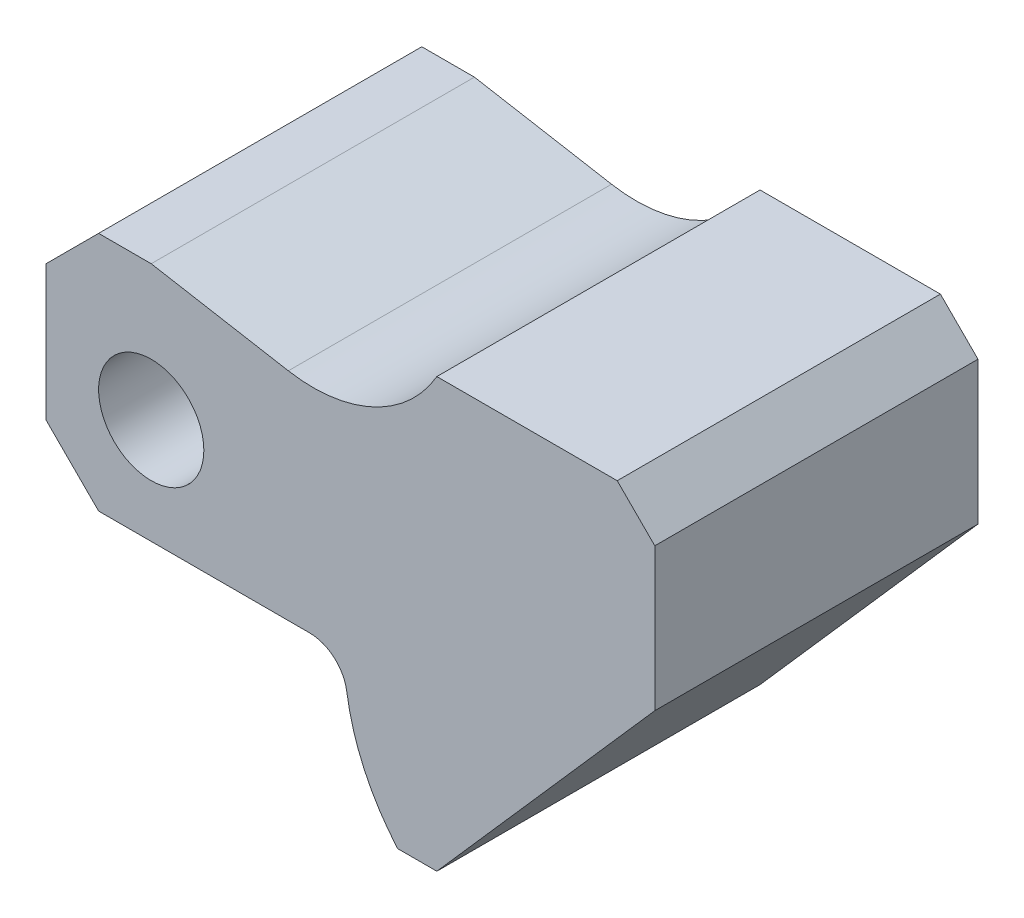
from build123d import *

# Parameters (mm, degrees)
BOSS_EXTRU_1_DEPTH      = 21.5
ESQUISSE2_R             = 7
ENL_V_MAT_EXTRU_1_DEPTH = 86.364648718


with BuildPart() as part:
    # Esquisse1 → Boss.-Extru.1 (new, symmetric)
    with BuildSketch(Plane.XY):
        with BuildLine():
            Line((0, 0), (5.211932603, 0))
            Line((5.211932603, 0), (34.211932603, 33))
            Line((34.211932603, 33), (34.211932603, 52))
            Line((34.211932603, 52), (29.211932603, 57))
            Line((29.211932603, 57), (5.211932603, 57))
            ThreePointArc((5.211932603, 57), (-3.213094436, 49.276069151), (-14.544982409, 47.783251905))
            Line((-14.544982409, 47.783251905), (-32.788067397, 51))
            Line((-32.788067397, 51), (-39.788067397, 51))
            Line((-39.788067397, 51), (-46.788067397, 44))
            Line((-46.788067397, 44), (-46.788067397, 26))
            Line((-46.788067397, 26), (-39.788067397, 19))
            Line((-39.788067397, 19), (-11.721441141, 19))
            ThreePointArc((-11.721441141, 19), (-8.45620536, 17.786586232), (-6.7758024, 14.735294118))
            ThreePointArc((-6.7758024, 14.735294118), (-4.438972197, 6.884327939), (0, 0))
        make_face()
    extrude(amount=BOSS_EXTRU_1_DEPTH, both=True)

    # Esquisse2 → Enlèv. mat.-Extru.1 (cut, through all)
    with BuildSketch(Plane.XY.offset(21.5)):
        with Locations((-32.788067397, 33)):
            Circle(ESQUISSE2_R)
    extrude(amount=-ENL_V_MAT_EXTRU_1_DEPTH, mode=Mode.SUBTRACT)


solid = part.part
